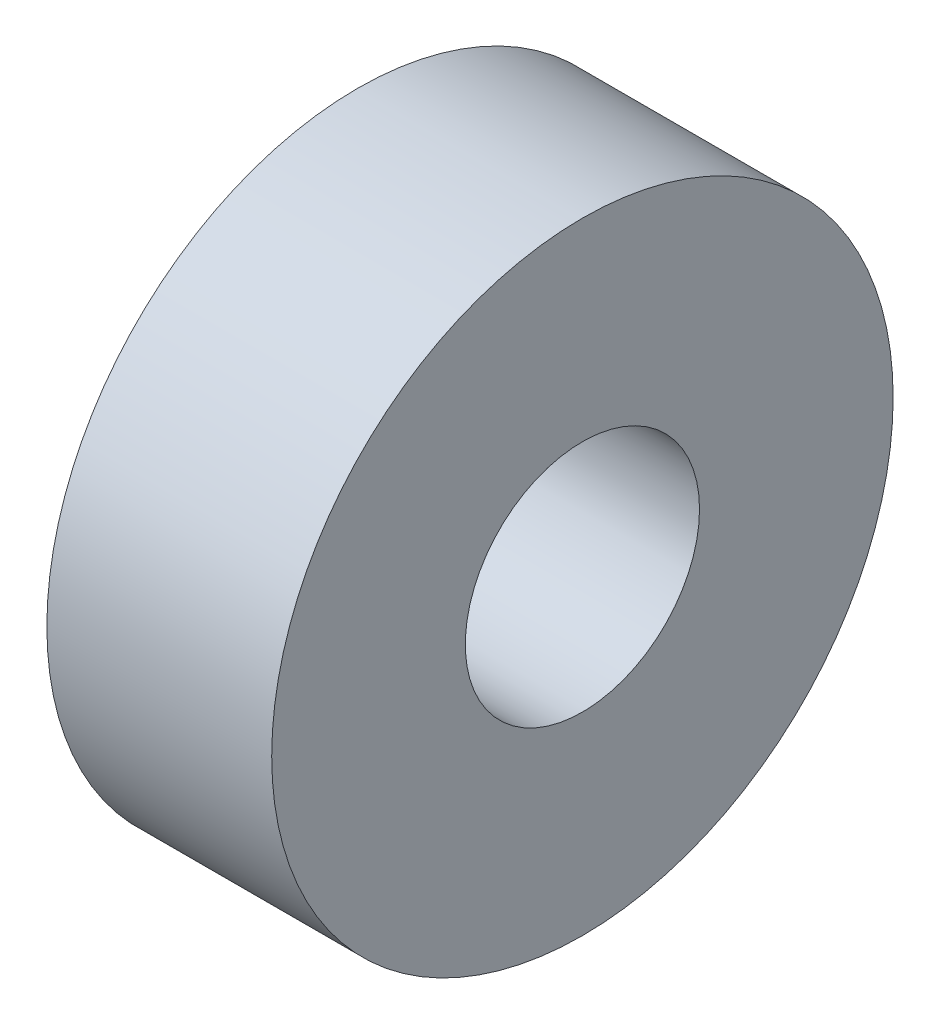
from build123d import *

# Parameters (mm, degrees)
SKETCH1_R           = 12.6365
BOSS_EXTRUDE1_DEPTH = 9.144
SKETCH2_R           = 4.7625
CUT_EXTRUDE1_DEPTH  = 9.144


with BuildPart() as part:
    # Sketch1 → Boss-Extrude1 (new body)
    with BuildSketch(Plane(origin=(0, 0, 0), x_dir=(0, 0, -1), z_dir=(1, 0, 0))):
        with Locations((-30.648100176, 14.79106722)):
            Circle(SKETCH1_R)
    extrude(amount=BOSS_EXTRUDE1_DEPTH)

    # Sketch2 → Cut-Extrude1 (cut)
    with BuildSketch(Plane(origin=(9.144, 0, 0), x_dir=(0, 0, -1), z_dir=(1, 0, 0))):
        with Locations((-30.648100176, 14.79106722)):
            Circle(SKETCH2_R)
    extrude(amount=-CUT_EXTRUDE1_DEPTH, mode=Mode.SUBTRACT)


solid = part.part
